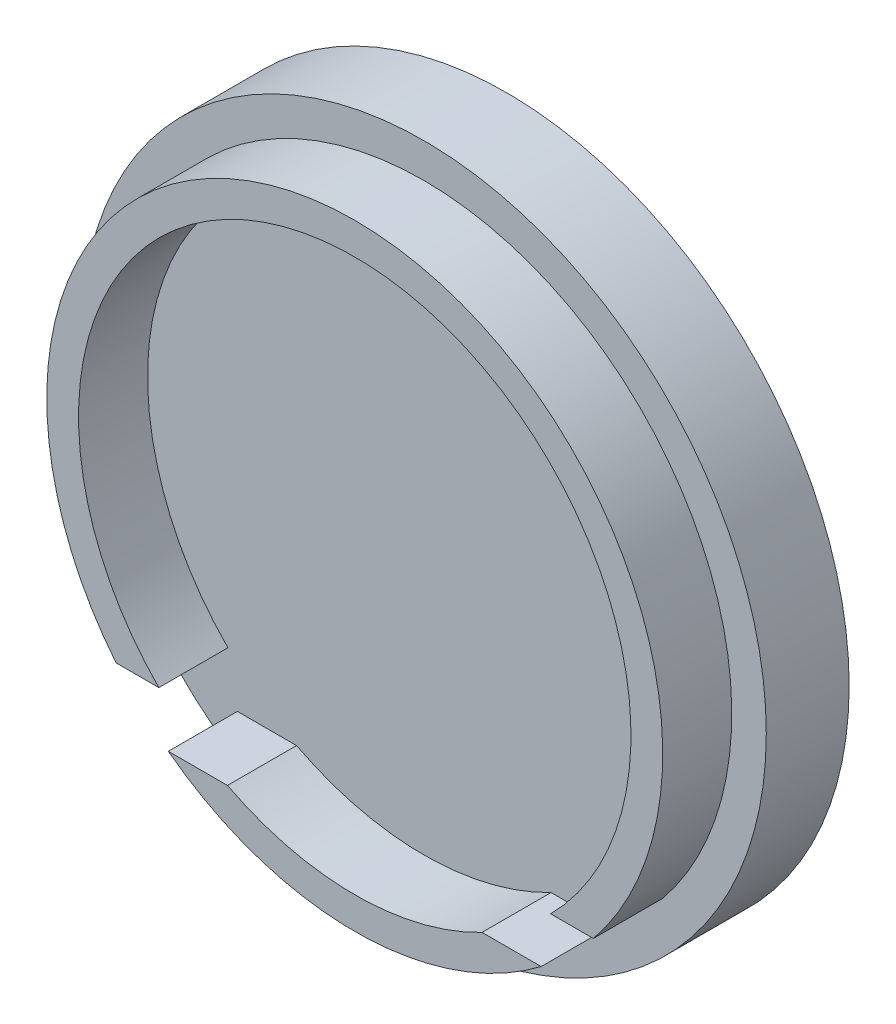
from build123d import *

# Parameters (mm, degrees)
SKETCH1_R           = 24.8
BOSS_EXTRUDE1_DEPTH = 6
SKETCH2_R           = 22.3
SKETCH2_R_2         = 20
BOSS_EXTRUDE2_DEPTH = 5
CUT_EXTRUDE1_START  = -5
CUT_EXTRUDE1_DEPTH  = 5


with BuildPart() as part:
    # Sketch1 → Boss-Extrude1 (new body)
    with BuildSketch(Plane.XY):
        Circle(SKETCH1_R)
    extrude(amount=BOSS_EXTRUDE1_DEPTH)

    # Sketch2 → Boss-Extrude2 (add)
    with BuildSketch(Plane.XY.offset(6)):
        Circle(SKETCH2_R)
        Circle(SKETCH2_R_2, mode=Mode.SUBTRACT)
    extrude(amount=BOSS_EXTRUDE2_DEPTH)

    # Sketch3 → Cut-Extrude1 (cut)
    with BuildSketch(Plane.XY.offset(11).offset(CUT_EXTRUDE1_START)):
        with BuildLine():
            Line((-13.499166641, -17.75), (-9.216154296, -17.75))
            ThreePointArc((-9.216154296, -17.75), (-11.841627397, -16.11756373), (-14.184146079, -14.1))
            Line((-14.184146079, -14.1), (-17.276573734, -14.1))
            ThreePointArc((-17.276573734, -14.1), (-15.495714695, -16.036608934), (-13.499166641, -17.75))
        make_face()
        with BuildLine():
            Line((17.276573734, -14.1), (14.184146079, -14.1))
            ThreePointArc((14.184146079, -14.1), (11.841627397, -16.11756373), (9.216154296, -17.75))
            Line((9.216154296, -17.75), (13.499166641, -17.75))
            ThreePointArc((13.499166641, -17.75), (15.495714695, -16.036608934), (17.276573734, -14.1))
        make_face()
    extrude(amount=CUT_EXTRUDE1_DEPTH, mode=Mode.SUBTRACT)


solid = part.part
